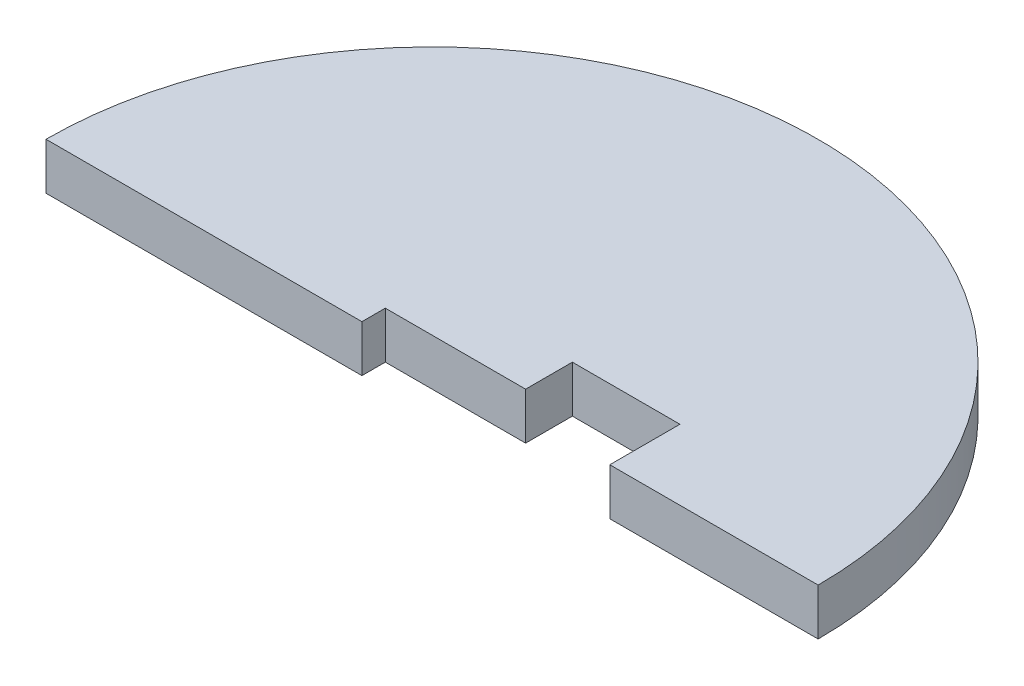
from build123d import *

# Parameters (mm, degrees)
SKETCH1_R           = 82.55
BOSS_EXTRUDE1_DEPTH = 10
SKETCH3_OUTSIDE_W   = 213.84
SKETCH3_OUTSIDE_H   = 213.84
CUT_EXTRUDE2_DEPTH  = 10
SKETCH4_W           = 30
SKETCH4_H           = 10
CUT_EXTRUDE3_DEPTH  = 13
SKETCH6_W           = 23
SKETCH6_H           = 30
CUT_EXTRUDE5_DEPTH  = 10


with BuildPart() as part:
    # Sketch1 → Boss-Extrude1 (new body)
    with BuildSketch(Plane(origin=(0, 0, 0), x_dir=(1, 0, 0), z_dir=(0, 1, 0))):
        with Locations(Location((0, 0, 0), (0, 0, 270))):
            Circle(SKETCH1_R)
    extrude(amount=BOSS_EXTRUDE1_DEPTH)

    # Sketch3 outside → Cut-Extrude2 (cut)
    with BuildSketch(Plane(origin=(0, 10, 0), x_dir=(1, 0, 0), z_dir=(0, 1, 0))):
        Rectangle(SKETCH3_OUTSIDE_W, SKETCH3_OUTSIDE_H)
        with BuildLine():
            Line((-82.55, 0), (82.55, 0))
            ThreePointArc((82.55, 0), (0, 82.55), (-82.55, 0))
        make_face(mode=Mode.SUBTRACT)
    extrude(amount=-CUT_EXTRUDE2_DEPTH, mode=Mode.SUBTRACT)

    # Sketch4 → Cut-Extrude3 (cut)
    with BuildSketch(Plane(origin=(0, 13, 0), x_dir=(1, 0, 0), z_dir=(0, 1, 0))):
        Rectangle(SKETCH4_W, SKETCH4_H)
    extrude(amount=-CUT_EXTRUDE3_DEPTH, mode=Mode.SUBTRACT)

    # Sketch6 → Cut-Extrude5 (cut)
    with BuildSketch(Plane(origin=(0, 10, 0), x_dir=(1, 0, 0), z_dir=(0, 1, 0))):
        with Locations((26.5, 0)):
            Rectangle(SKETCH6_W, SKETCH6_H)
    extrude(amount=-CUT_EXTRUDE5_DEPTH, mode=Mode.SUBTRACT)


solid = part.part
